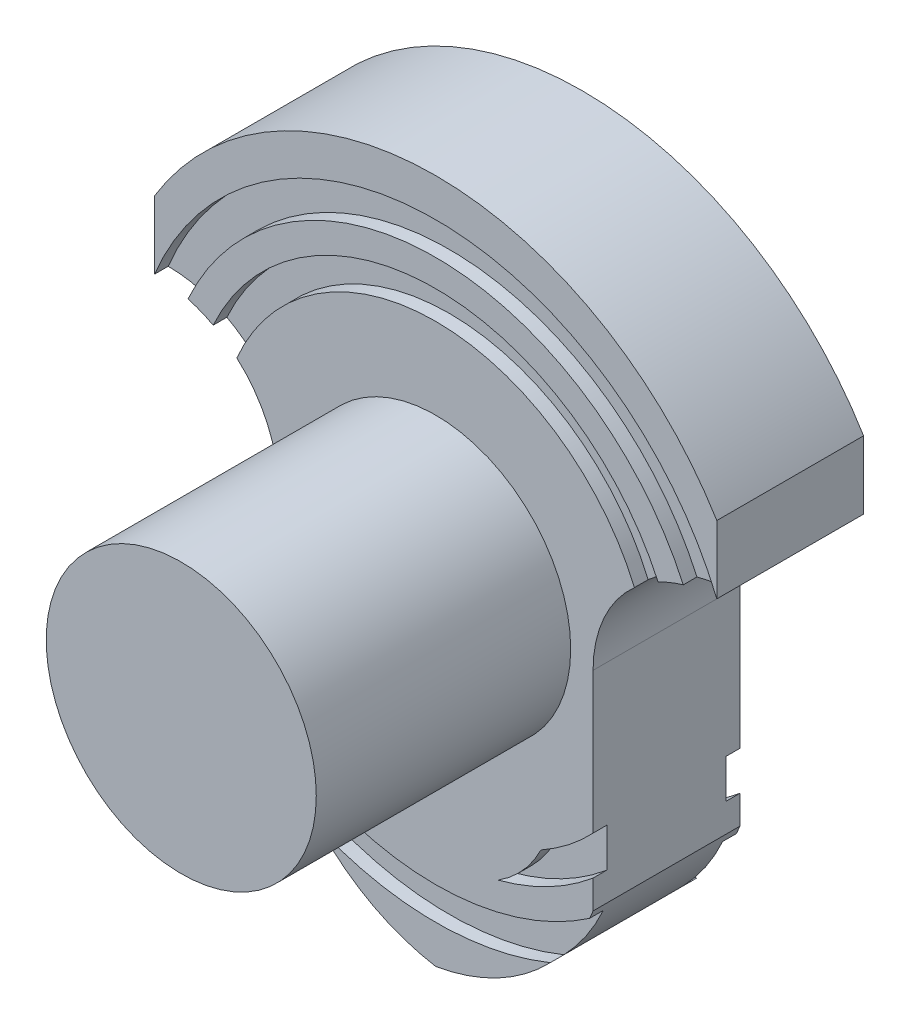
from build123d import *

# Parameters (mm, degrees)
SKETCH2_R           = 15.24
BOSS_EXTRUDE2_DEPTH = 19.05
SKETCH3_R           = 39.496431486
SKETCH3_R_2         = 35.260007957
CUT_EXTRUDE2_DEPTH  = 1.778
SKETCH4_R           = 31.746180351
SKETCH4_R_2         = 28.068999156
CUT_EXTRUDE3_DEPTH  = 1.778
CUT_EXTRUDE4_START  = -1.778
SKETCH5_R           = 39.496431486
SKETCH5_R_2         = 35.260007957
CUT_EXTRUDE4_DEPTH  = 1.778
CUT_EXTRUDE5_START  = -1.778
SKETCH7_R           = 31.746180351
SKETCH7_R_2         = 28.068999156
CUT_EXTRUDE5_DEPTH  = 1.778
BOSS_EXTRUDE3_START = -6.35
SKETCH9_R           = 15.24
BOSS_EXTRUDE3_DEPTH = 6.35
SKETCH10_R          = 17.526
BOSS_EXTRUDE4_DEPTH = 33.02


with BuildPart() as part:
    # Sketch2 → Boss-Extrude2 (new body)
    with BuildSketch(Plane.XY):
        with BuildLine():
            Line((20.429296249, -72.446914532), (20.429296249, -45.399816154))
            ThreePointArc((20.429296249, -45.399816154), (25.133677026, -34.04243628), (36.4910569, -29.338055504))
            Line((36.4910569, -29.338055504), (36.4910569, -20.532405534))
            ThreePointArc((36.4910569, -20.532405534), (20.935477727, -5.485511485), (0, 0))
            ThreePointArc((0, 0), (-20.935477727, -5.485511485), (-36.4910569, -20.532405534))
            Line((-36.4910569, -20.532405534), (-36.4910569, -29.338055504))
            ThreePointArc((-36.4910569, -29.338055504), (-25.133677026, -34.04243628), (-20.429296249, -45.399816154))
            Line((-20.429296249, -45.399816154), (-20.429296249, -72.446914532))
            ThreePointArc((-20.429296249, -72.446914532), (-12.360356233, -83.33771782), (0, -88.9))
            ThreePointArc((0, -88.9), (12.360356233, -83.33771782), (20.429296249, -72.446914532))
        make_face()
        with Locations(Location((0, -62.23, 0), (0, 0, 180))):
            Circle(SKETCH2_R, mode=Mode.SUBTRACT)
    extrude(amount=BOSS_EXTRUDE2_DEPTH)

    # Sketch3 → Cut-Extrude2 (cut)
    with BuildSketch(Plane.XY.offset(19.05)):
        with Locations((0, -44.45)):
            Circle(SKETCH3_R)
        with Locations((0, -44.45)):
            Circle(SKETCH3_R_2, mode=Mode.SUBTRACT)
    extrude(amount=-CUT_EXTRUDE2_DEPTH, mode=Mode.SUBTRACT)

    # Sketch4 → Cut-Extrude3 (cut)
    with BuildSketch(Plane.XY.offset(19.05)):
        with Locations((0, -44.45)):
            Circle(SKETCH4_R)
        with Locations((0, -44.45)):
            Circle(SKETCH4_R_2, mode=Mode.SUBTRACT)
    extrude(amount=-CUT_EXTRUDE3_DEPTH, mode=Mode.SUBTRACT)

    # Sketch5 → Cut-Extrude4 (cut)
    with BuildSketch(Plane(origin=(0, 0, 0), x_dir=(-1, 0, 0), z_dir=(0, 0, -1)).offset(CUT_EXTRUDE4_START)):
        with Locations((0, -44.45)):
            Circle(SKETCH5_R)
        with Locations((0, -44.45)):
            Circle(SKETCH5_R_2, mode=Mode.SUBTRACT)
    extrude(amount=CUT_EXTRUDE4_DEPTH, mode=Mode.SUBTRACT)

    # Sketch7 → Cut-Extrude5 (cut)
    with BuildSketch(Plane(origin=(0, 0, 0), x_dir=(-1, 0, 0), z_dir=(0, 0, -1)).offset(CUT_EXTRUDE5_START)):
        with Locations((0, -44.45)):
            Circle(SKETCH7_R)
        with Locations((0, -44.45)):
            Circle(SKETCH7_R_2, mode=Mode.SUBTRACT)
    extrude(amount=CUT_EXTRUDE5_DEPTH, mode=Mode.SUBTRACT)

    # Sketch9 → Boss-Extrude3 (add)
    with BuildSketch(Plane.XY.offset(19.05).offset(BOSS_EXTRUDE3_START)):
        with Locations(Location((0, -62.23, 0), (0, 0, 206.225395775))):
            Circle(SKETCH9_R)
    extrude(amount=BOSS_EXTRUDE3_DEPTH)

    # Sketch10 → Boss-Extrude4 (add)
    with BuildSketch(Plane.XY.offset(19.05)):
        with Locations((0, -44.45)):
            Circle(SKETCH10_R)
    extrude(amount=BOSS_EXTRUDE4_DEPTH)


solid = part.part
